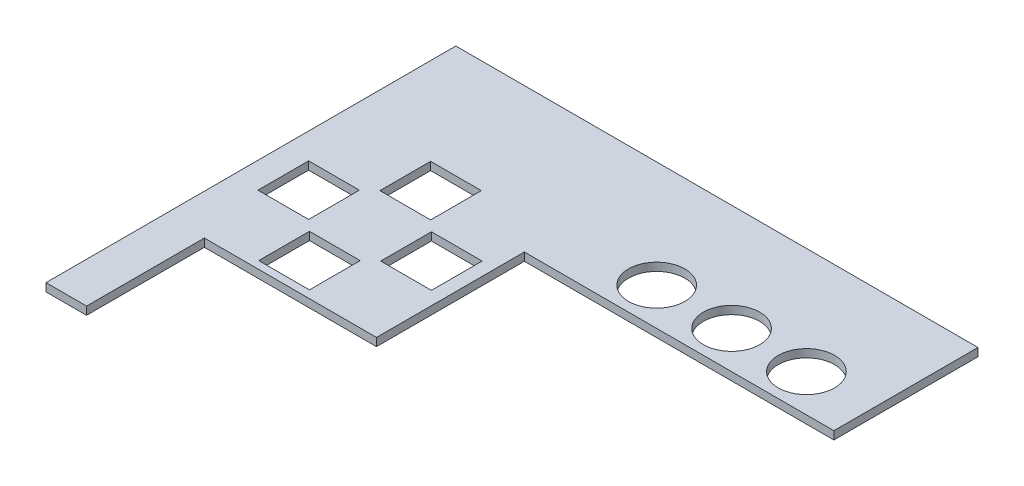
from build123d import *

# Parameters (mm, degrees)
SKETCH1_W           = 64.85
SKETCH1_H           = 50.9
BOSS_EXTRUDE1_DEPTH = 1
SKETCH2_W           = 6.3
SKETCH2_H           = 6.3
SKETCH2_R           = 2.25
CUT_EXTRUDE1_DEPTH  = 10
SKETCH3_R           = 3.5
CUT_EXTRUDE2_DEPTH  = 10
CUT_EXTRUDE3_DEPTH  = 10


with BuildPart() as part:
    # Sketch1 → Boss-Extrude1 (new body)
    with BuildSketch(Plane(origin=(0, 0, 0), x_dir=(1, 0, 0), z_dir=(0, 1, 0))):
        Rectangle(SKETCH1_W, SKETCH1_H)
    extrude(amount=BOSS_EXTRUDE1_DEPTH)

    # Sketch2 → Cut-Extrude1 (cut)
    # profile 1 of 4: a face of its own
    with BuildSketch(Plane(origin=(0, 1, 0), x_dir=(1, 0, 0), z_dir=(0, 1, 0))):
        with Locations((-26.061755396, 0.805169379)):
            Rectangle(SKETCH2_W, SKETCH2_H)
        with Locations((-26.061755396, 0.805169379)):
            Circle(SKETCH2_R, mode=Mode.SUBTRACT)
    # profile 2 of 4: a face of its own
    with BuildSketch(Plane(origin=(0, 1, 0), x_dir=(1, 0, 0), z_dir=(0, 1, 0))):
        with Locations((-10.811755396, 0.805169379)):
            Rectangle(SKETCH2_W, SKETCH2_H)
        with Locations((-10.811755396, 0.805169379)):
            Circle(SKETCH2_R, mode=Mode.SUBTRACT)
    # profile 3 of 4: a face of its own
    with BuildSketch(Plane(origin=(0, 1, 0), x_dir=(1, 0, 0), z_dir=(0, 1, 0))):
        with Locations((-18.436755396, 8.330169379)):
            Rectangle(SKETCH2_W, SKETCH2_H)
        with Locations((-18.436755396, 8.330169379)):
            Circle(SKETCH2_R, mode=Mode.SUBTRACT)
    # profile 4 of 4: a face of its own
    with BuildSketch(Plane(origin=(0, 1, 0), x_dir=(1, 0, 0), z_dir=(0, 1, 0))):
        with Locations((-18.436755396, -6.719830621)):
            Rectangle(SKETCH2_W, SKETCH2_H)
        with Locations((-18.436755396, -6.719830621)):
            Circle(SKETCH2_R, mode=Mode.SUBTRACT)
    extrude(amount=-CUT_EXTRUDE1_DEPTH, mode=Mode.SUBTRACT)


with BuildPart() as cut_extrude1_kept_piece:
    # of the separate pieces the step leaves, the one the design keeps (cut_extrude1_pieces_kept)
    add(part.part.solids().sort_by_distance((32.425, 0, 25.45))[0])

    # Sketch3 → Cut-Extrude2 (cut)
    with BuildSketch(Plane(origin=(0, 1, 0), x_dir=(1, 0, 0), z_dir=(0, 1, 0))):
        with Locations(Location((5.766564163, 12.20008786, 0), (0, 0, 270))):
            Circle(SKETCH3_R)
        with Locations(Location((15.066564163, 12.20008786, 0), (0, 0, 270))):
            Circle(SKETCH3_R)
        with Locations(Location((24.366564163, 12.20008786, 0), (0, 0, 270))):
            Circle(SKETCH3_R)
    extrude(amount=-CUT_EXTRUDE2_DEPTH, mode=Mode.SUBTRACT)

    # Sketch6 → Cut-Extrude3 (cut)
    with BuildSketch(Plane(origin=(0, 1, 0), x_dir=(1, 0, 0), z_dir=(0, 1, 0))):
        Polygon((-6.013732281, -10.818181441), (-6.013732281, 7.549848679), (32.425, 7.549848679), (32.425, -25.45), (-27.388628542, -25.45), (-27.388628542, -10.818181441), align=None)
    extrude(amount=-CUT_EXTRUDE3_DEPTH, mode=Mode.SUBTRACT)


solid = cut_extrude1_kept_piece.part
